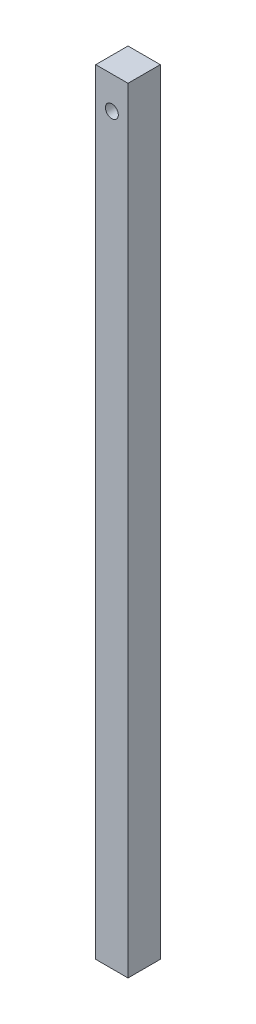
from build123d import *

# Parameters (mm, degrees)
SKETCH1_W           = 5
SKETCH1_H           = 120
BOSS_EXTRUDE1_DEPTH = 5
SKETCH2_R           = 1
CUT_EXTRUDE1_DEPTH  = 10


with BuildPart() as part:
    # Sketch1 → Boss-Extrude1 (new body)
    with BuildSketch(Plane.XY):
        with Locations((0, 60)):
            Rectangle(SKETCH1_W, SKETCH1_H)
    extrude(amount=BOSS_EXTRUDE1_DEPTH)

    # Sketch2 → Cut-Extrude1 (cut, symmetric)
    with BuildSketch(Plane.XY):
        with Locations((0, 115)):
            Circle(SKETCH2_R)
    extrude(amount=CUT_EXTRUDE1_DEPTH, both=True, mode=Mode.SUBTRACT)


solid = part.part
